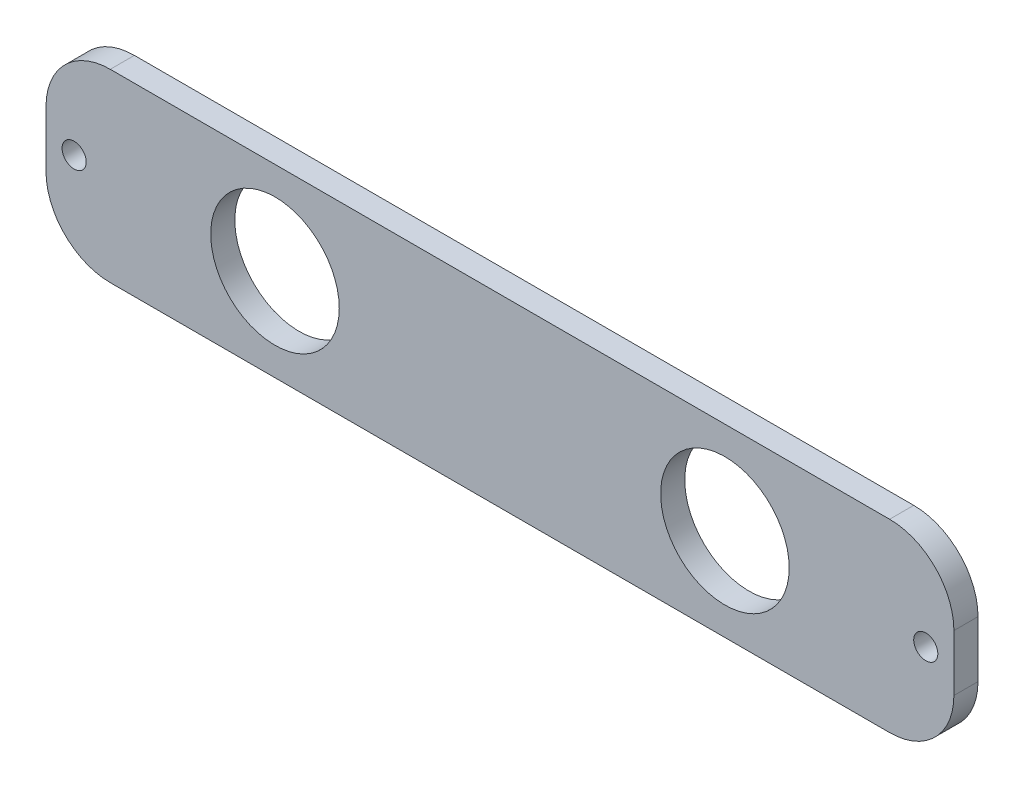
from build123d import *

# Parameters (mm, degrees)
EXTRUDE_2_DEPTH     = 3
SKETCH_5_R          = 1.5
SKETCH_5_R_2        = 8
CUT_EXTRUDE_1_DEPTH = 3


with BuildPart() as part:
    # 草图1 → 凸台-拉伸2 (new body)
    with BuildSketch(Plane.XY):
        with BuildLine():
            Line((-41.418768197, 30.558517452), (55.581231803, 30.558517452))
            ThreePointArc((55.581231803, 30.558517452), (61.238086052, 28.215371701), (63.581231803, 22.558517452))
            Line((63.581231803, 22.558517452), (63.581231803, 15.558517452))
            ThreePointArc((63.581231803, 15.558517452), (61.238086052, 9.901663202), (55.581231803, 7.558517452))
            Line((55.581231803, 7.558517452), (-41.418768197, 7.558517452))
            ThreePointArc((-41.418768197, 7.558517452), (-47.075622447, 9.901663202), (-49.418768197, 15.558517452))
            Line((-49.418768197, 15.558517452), (-49.418768197, 22.558517452))
            ThreePointArc((-49.418768197, 22.558517452), (-47.075622447, 28.215371701), (-41.418768197, 30.558517452))
        make_face()
    extrude(amount=EXTRUDE_2_DEPTH)

    # 草图5 → 切除-拉伸1 (cut)
    with BuildSketch(Plane.XY.offset(3)):
        with Locations((-45.918768197, 19.058517452)):
            Circle(SKETCH_5_R)
        with Locations((60.081231803, 19.058517452)):
            Circle(SKETCH_5_R)
        with Locations((-20.918768197, 19.058517452)):
            Circle(SKETCH_5_R_2)
        with Locations((35.081231803, 19.058517452)):
            Circle(SKETCH_5_R_2)
    extrude(amount=-CUT_EXTRUDE_1_DEPTH, mode=Mode.SUBTRACT)


solid = part.part
